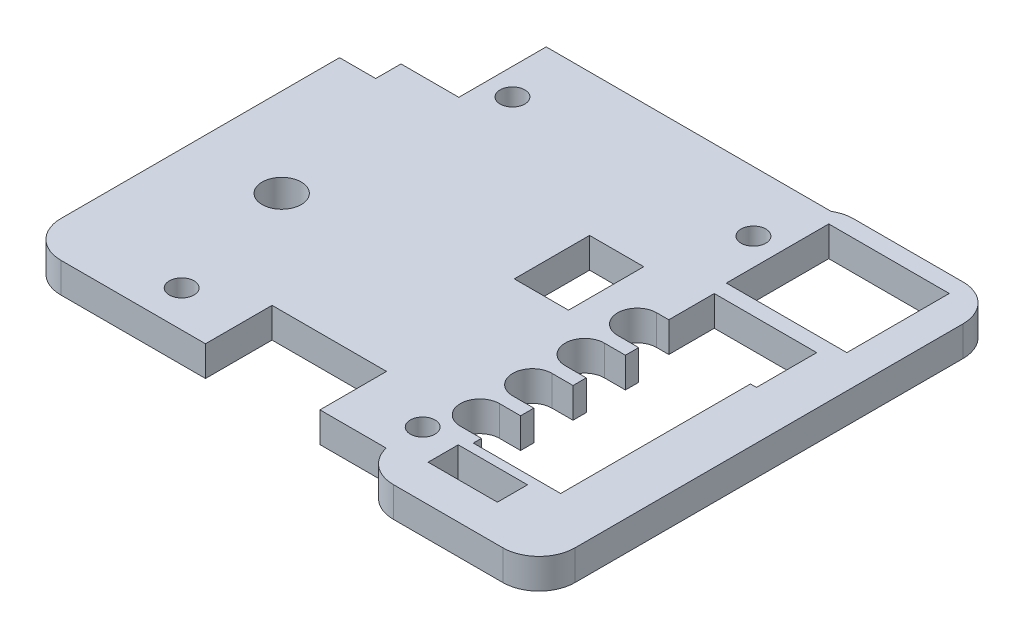
from build123d import *

# Parameters (mm, degrees)
SKETCH_2_R          = 6.05
SKETCH_2_R_2        = 2.05
EXTRUDE_1_DEPTH     = 5
EXTRUDE_1_2_DEPTH   = 5
EXTRUDE_1_3_DEPTH   = 5
EXTRUDE_1_4_DEPTH   = 5
SKETCH_6_R          = 2.05
EXTRUDE_1_5_DEPTH   = 5
SKETCH_11_R         = 3.25
SKETCH_11_W         = 19
SKETCH_11_H         = 11.05
SKETCH_11_W_2       = 20
SKETCH_11_H_2       = 17
SKETCH_11_W_3       = 9
SKETCH_11_H_3       = 12.5
SKETCH_11_W_4       = 11.5
SKETCH_11_H_4       = 5
CUT_EXTRUDE_4_DEPTH = 151.533194014
CUT_EXTRUDE_5_DEPTH = 153.920706577


with BuildPart() as part:
    # 草图2 → Extrude 1 (new body)
    with BuildSketch(Plane(origin=(0, 0, 0), x_dir=(-1, 0, 0), z_dir=(0, -1, 0))):
        with Locations((-103.2, -9.35)):
            Circle(SKETCH_2_R)
        with Locations((-103.2, -9.35)):
            Circle(SKETCH_2_R_2, mode=Mode.SUBTRACT)
    extrude(amount=EXTRUDE_1_DEPTH)



with BuildPart() as body_2:
    # 草图2 → Extrude 1 2 (new body)
    with BuildSketch(Plane(origin=(0, 0, 0), x_dir=(-1, 0, 0), z_dir=(0, -1, 0))):
        with Locations((-63.2, -9.35)):
            Circle(SKETCH_2_R)
        with Locations((-63.2, -9.35)):
            Circle(SKETCH_2_R_2, mode=Mode.SUBTRACT)
    extrude(amount=EXTRUDE_1_2_DEPTH)


with BuildPart() as body_3:
    # 草图2 → Extrude 1 3 (new body)
    with BuildSketch(Plane(origin=(0, 0, 0), x_dir=(-1, 0, 0), z_dir=(0, -1, 0))):
        with Locations((-63.2, -64.25)):
            Circle(SKETCH_2_R)
        with Locations((-63.2, -64.25)):
            Circle(SKETCH_2_R_2, mode=Mode.SUBTRACT)
    extrude(amount=EXTRUDE_1_3_DEPTH)


with BuildPart() as body_4:
    # 草图2 → Extrude 1 4 (new body)
    with BuildSketch(Plane(origin=(0, 0, 0), x_dir=(-1, 0, 0), z_dir=(0, -1, 0))):
        with Locations((-103.2, -64.25)):
            Circle(SKETCH_2_R)
        with Locations((-103.2, -64.25)):
            Circle(SKETCH_2_R_2, mode=Mode.SUBTRACT)
    extrude(amount=EXTRUDE_1_4_DEPTH)


with BuildPart() as part_1:
    add(part.part)

    add(body_2.part)  # Extrude 1 5 merges body 2

    add(body_3.part)  # Extrude 1 5 merges body 3

    add(body_4.part)  # Extrude 1 5 merges body 4
    # 草图6 → Extrude 1 5 (add)
    with BuildSketch(Plane(origin=(0, 0, 0), x_dir=(1, 0, 0), z_dir=(0, 1, 0))):
        with BuildLine():
            Line((127.2, 1.45), (109.046152581, 1.45))
            ThreePointArc((109.046152581, 1.45), (107.496959242, 1.246550698), (106.052826672, 0.65))
            Line((106.052826672, 0.65), (63.2, 0.65))
            Line((63.2, 0.65), (45.7, 0.65))
            ThreePointArc((45.7, 0.65), (43.932233047, -0.082233047), (43.2, -1.85))
            Line((43.2, -1.85), (43.2, -64.3))
            ThreePointArc((43.2, -64.3), (44.957359313, -68.542640687), (49.2, -70.3))
            Line((49.2, -70.3), (103.2, -70.3))
            ThreePointArc((103.2, -70.3), (105.311182702, -73.645742753), (109.046152581, -74.95))
            Line((109.046152581, -74.95), (127.2, -74.95))
            ThreePointArc((127.2, -74.95), (131.442640687, -73.192640687), (133.2, -68.95))
            Line((133.2, -68.95), (133.2, -4.55))
            ThreePointArc((133.2, -4.55), (131.442640687, -0.307359313), (127.2, 1.45))
        make_face()
        with Locations(Location((103.2, -9.35, 0), (0, 0, 270))):
            Circle(SKETCH_6_R, mode=Mode.SUBTRACT)
        with Locations(Location((103.2, -64.25, 0), (0, 0, 270))):
            Circle(SKETCH_6_R, mode=Mode.SUBTRACT)
        with Locations(Location((63.2, -64.25, 0), (0, 0, 270))):
            Circle(SKETCH_6_R, mode=Mode.SUBTRACT)
        with Locations(Location((63.2, -9.35, 0), (0, 0, 90))):
            Circle(SKETCH_6_R, mode=Mode.SUBTRACT)
    extrude(amount=-EXTRUDE_1_5_DEPTH)

    # 草图11 → 切除-拉伸4 (cut, through all)
    with BuildSketch(Plane(origin=(0, -5, 5), x_dir=(1, 0, 0), z_dir=(0, -1, 0))):
        Polygon((49.2, 13.05), (43.2, 13.05), (43.2, 6.35), (45.8, 6.35), (45.8, -3.15), (58.8, -3.15), (58.8, 8.85), (49.2, 8.85), align=None)
        with Locations(Location((57.9, 37.35, 0), (0, 0, 90))):
            Circle(SKETCH_11_R)
        with Locations((82.7, 59.775)):
            Rectangle(SKETCH_11_W, SKETCH_11_H)
        with Locations((117.7, 4.85)):
            Rectangle(SKETCH_11_W_2, SKETCH_11_H_2)
        with Locations((94, 24.1)):
            Rectangle(SKETCH_11_W_3, SKETCH_11_H_3)
        with Locations((114.45, 61.35)):
            Rectangle(SKETCH_11_W_4, SKETCH_11_H_4)
        with BuildLine():
            ThreePointArc((106.2, 29.9), (102.95, 26.65), (106.2, 23.4))
            Line((106.2, 23.4), (108.2, 23.4))
            Line((108.2, 23.4), (108.2, 15.85))
            Line((108.2, 15.85), (125.2, 15.85))
            Line((125.2, 15.85), (125.2, 25.85))
            Line((125.2, 25.85), (124.2, 25.85))
            Line((124.2, 25.85), (124.2, 57.35))
            Line((124.2, 57.35), (109.7, 57.35))
            Line((109.7, 57.35), (109.7, 56))
            Line((109.7, 56), (106.2, 56))
            ThreePointArc((106.2, 56), (102.95, 52.75), (106.2, 49.5))
            Line((106.2, 49.5), (109.7, 49.5))
            Line((109.7, 49.5), (109.7, 47.3))
            Line((109.7, 47.3), (106.2, 47.3))
            ThreePointArc((106.2, 47.3), (102.95, 44.05), (106.2, 40.8))
            Line((106.2, 40.8), (109.7, 40.8))
            Line((109.7, 40.8), (109.7, 38.6))
            Line((109.7, 38.6), (106.2, 38.6))
            ThreePointArc((106.2, 38.6), (102.95, 35.35), (106.2, 32.1))
            Line((106.2, 32.1), (109.7, 32.1))
            Line((109.7, 32.1), (109.7, 29.9))
            Line((109.7, 29.9), (106.2, 29.9))
        make_face()
    extrude(amount=-CUT_EXTRUDE_4_DEPTH, mode=Mode.SUBTRACT)

    # 草图12 → Cut-Extrude 5 (cut, through all)
    with BuildSketch(Plane.XZ.offset(5)):
        with BuildLine():
            Line((58.8, -0.65), (58.8, 1.85))
            Line((58.8, 1.85), (45.8, 1.85))
            Line((45.8, 1.85), (45.8, 11.35))
            Line((45.8, 11.35), (43.2, 11.35))
            Line((43.2, 11.35), (43.2, 1.85))
            ThreePointArc((43.2, 1.85), (43.932233047, 0.082233047), (45.7, -0.65))
            Line((45.7, -0.65), (58.8, -0.65))
        make_face()
    extrude(amount=-CUT_EXTRUDE_5_DEPTH, mode=Mode.SUBTRACT)


solid = part_1.part
